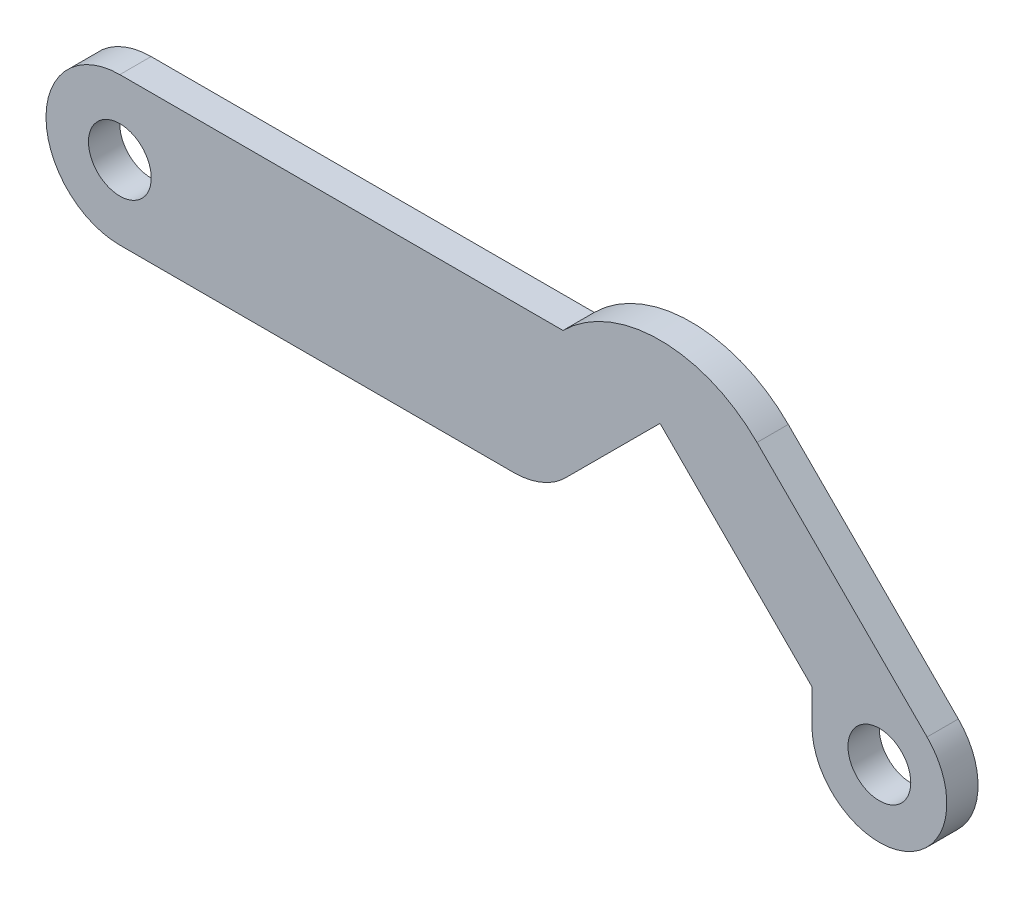
from build123d import *

# Parameters (mm, degrees)
SKETCH1_R            = 3.175
SKETCH1_R_2          = 4.8
BOSS_EXTRUDE1_DEPTH  = 3.175
SKETCH2_W            = 15
SKETCH2_H            = 3.175
CUT_EXTRUDE1_DEPTH   = 46.731068487
CUT_EXTRUDE2_START   = -10
CUT_EXTRUDE2_DEPTH   = 10
SKETCH4_W            = 11.581741037
SKETCH4_H            = 5.573186054
BOSS_EXTRUDE2_DEPTH  = 3.175
SKETCH5_R            = 1.475
CUT_EXTRUDE3_DEPTH   = 16
SKETCH6_W            = 21.273258962
SKETCH6_H            = 7.408259511
BOSS_EXTRUDE4_DEPTH  = 3.175
SKETCH12_R           = 4.8
CUT_EXTRUDE5_DEPTH   = 10
SKETCH15_R           = 4.85
BOSS_EXTRUDE10_DEPTH = 3.175
BOSS_EXTRUDE11_DEPTH = 3.175
BOSS_EXTRUDE12_DEPTH = 3.175
CUT_EXTRUDE6_DEPTH   = 10
CUT_EXTRUDE7_DEPTH   = 10
BOSS_EXTRUDE13_DEPTH = 3.175
BOSS_EXTRUDE14_DEPTH = 3.175
CUT_EXTRUDE8_DEPTH   = 10
SKETCH8_W            = 10
SKETCH8_H            = 3.175
CUT_EXTRUDE4_DEPTH   = 10
BOSS_EXTRUDE15_DEPTH = 3.175
CUT_EXTRUDE10_DEPTH  = 10
CUT_EXTRUDE11_DEPTH  = 10
BOSS_EXTRUDE16_DEPTH = 3.175
CUT_EXTRUDE12_DEPTH  = 3.175
BOSS_EXTRUDE18_DEPTH = 3.175
CUT_EXTRUDE13_DEPTH  = 3.175
BOSS_EXTRUDE19_DEPTH = 3.175
SKETCH32_R           = 6.716159248
SKETCH32_R_2         = 3.1875
BOSS_EXTRUDE20_DEPTH = 3.175
SKETCH33_R           = 7.5
SKETCH33_R_2         = 3.1875
BOSS_EXTRUDE21_DEPTH = 3.175
BOSS_EXTRUDE22_DEPTH = 3.175


with BuildPart() as part:
    # Sketch1 → Boss-Extrude1 (new body)
    with BuildSketch(Plane.XY):
        with BuildLine():
            Line((-37.5, 7.5), (37.5, 7.5))
            ThreePointArc((37.5, 7.5), (45, 0), (37.5, -7.5))
            Line((37.5, -7.5), (-37.5, -7.5))
            ThreePointArc((-37.5, -7.5), (-45, 0), (-37.5, 7.5))
        make_face()
        with Locations((-37.5, 0)):
            Circle(SKETCH1_R, mode=Mode.SUBTRACT)
        with Locations((37.5, 0)):
            Circle(SKETCH1_R_2, mode=Mode.SUBTRACT)
    extrude(amount=BOSS_EXTRUDE1_DEPTH)

    # Sketch2 → Cut-Extrude1 (cut, through all)
    with BuildSketch(Plane.XY.offset(3.175)):
        with Locations((-17.5, 0.21703664)):
            Rectangle(SKETCH2_W, SKETCH2_H)
        with Locations((17.5, 0.853492694)):
            Rectangle(SKETCH2_W, SKETCH2_H)
    extrude(amount=-CUT_EXTRUDE1_DEPTH, mode=Mode.SUBTRACT)

    # Sketch3 → Cut-Extrude2 (cut)
    with BuildSketch(Plane.XY.offset(3.175).offset(CUT_EXTRUDE2_START)):
        with BuildLine():
            Line((-56.505330914, 0), (-45, 0))
            ThreePointArc((-45, 0), (-42.803300859, 5.303300859), (-37.5, 7.5))
            Line((-37.5, 7.5), (-20.71, 7.5))
            Line((-20.71, 7.5), (-20.71, 17.128469338))
            Line((-20.71, 17.128469338), (-56.505330914, 17.128469338))
            Line((-56.505330914, 17.128469338), (-56.505330914, 0))
        make_face()
        with BuildLine():
            ThreePointArc((-37.5, -7.5), (-42.803300859, -5.303300859), (-45, 0))
            Line((-45, 0), (-56.505330914, 0))
            Line((-56.505330914, 0), (-56.505330914, -10.2398458))
            Line((-56.505330914, -10.2398458), (-20.71, -10.2398458))
            Line((-20.71, -10.2398458), (-20.71, -7.5))
            Line((-20.71, -7.5), (-37.5, -7.5))
        make_face()
        with BuildLine():
            ThreePointArc((-40.675, 0), (-37.5, 3.175), (-34.325, 0))
            Line((-34.325, 0), (-25, 0))
            Line((-25, 0), (-25, 1.80453664))
            Line((-25, 1.80453664), (-20.71, 1.80453664))
            Line((-20.71, 1.80453664), (-20.71, 7.5))
            Line((-20.71, 7.5), (-37.5, 7.5))
            ThreePointArc((-37.5, 7.5), (-42.803300859, 5.303300859), (-45, 0))
            Line((-45, 0), (-40.675, 0))
        make_face()
        with BuildLine():
            Line((-25, 0), (-34.325, 0))
            ThreePointArc((-34.325, 0), (-37.5, -3.175), (-40.675, 0))
            Line((-40.675, 0), (-45, 0))
            ThreePointArc((-45, 0), (-42.803300859, -5.303300859), (-37.5, -7.5))
            Line((-37.5, -7.5), (-20.71, -7.5))
            Line((-20.71, -7.5), (-20.71, -1.37046336))
            Line((-20.71, -1.37046336), (-25, -1.37046336))
            Line((-25, -1.37046336), (-25, 0))
        make_face()
    extrude(amount=CUT_EXTRUDE2_DEPTH, mode=Mode.SUBTRACT)

    # Sketch4 → Boss-Extrude2 (add)
    with BuildSketch(Plane.XY.offset(3.175)):
        with Locations((-14.919129482, -0.129821549)):
            Rectangle(SKETCH4_W, SKETCH4_H)
    extrude(amount=-BOSS_EXTRUDE2_DEPTH)

    # Sketch5 → Cut-Extrude3 (cut)
    with BuildSketch(Plane.XY.offset(3.175)):
        with Locations((-13.5, 0)):
            Circle(SKETCH5_R)
        with Locations((2.5, 0)):
            Circle(SKETCH5_R)
    extrude(amount=-CUT_EXTRUDE3_DEPTH, mode=Mode.SUBTRACT)

    # Sketch6 → Boss-Extrude4 (add)
    with BuildSketch(Plane.XY.offset(3.175)):
        with Locations((18.907585517, 0.667769414)):
            Rectangle(SKETCH6_W, SKETCH6_H)
    extrude(amount=-BOSS_EXTRUDE4_DEPTH)

    # Sketch12 → Cut-Extrude5 (cut)
    # profile 1 of 2: a face of its own
    with BuildSketch(Plane(origin=(0, 0, 0), x_dir=(-1, 0, 0), z_dir=(0, 0, -1))):
        with BuildLine():
            Line((-2.5, 7.5), (-37.5, 7.5))
            ThreePointArc((-37.5, 7.5), (-32.196699141, 5.303300859), (-30, 0))
            ThreePointArc((-30, 0), (-32.196699141, -5.303300859), (-37.5, -7.5))
            Line((-37.5, -7.5), (-2.5, -7.5))
            ThreePointArc((-2.5, -7.5), (-10, 0), (-2.5, 7.5))
        make_face()
    # profile 2 of 2: a face of its own
    with BuildSketch(Plane(origin=(0, 0, 0), x_dir=(-1, 0, 0), z_dir=(0, 0, -1))):
        with BuildLine():
            ThreePointArc((-30, 0), (-32.196699141, 5.303300859), (-37.5, 7.5))
            ThreePointArc((-37.5, 7.5), (-45, 0), (-37.5, -7.5))
            ThreePointArc((-37.5, -7.5), (-32.196699141, -5.303300859), (-30, 0))
        make_face()
        with Locations((-37.5, 0)):
            Circle(SKETCH12_R, mode=Mode.SUBTRACT)
    extrude(amount=-CUT_EXTRUDE5_DEPTH, mode=Mode.SUBTRACT)

    # Sketch15 → Boss-Extrude10 (add)
    with BuildSketch(Plane(origin=(0, 0, 0), x_dir=(-1, 0, 0), z_dir=(0, 0, -1))):
        with BuildLine():
            ThreePointArc((-46.001929081, -17.143138466), (-35.871769222, -20.337345998), (-34.79216247, -9.770532392))
            Line((-34.79216247, -9.770532392), (-34.739826286, -9.718196208))
            ThreePointArc((-34.739826286, -9.718196208), (-27.229011247, 7.510815039), (-10, 0))
            ThreePointArc((-10, 0), (-7.803300859, 5.303300859), (-2.5, 7.5))
            ThreePointArc((-2.5, 7.5), (-36.707777113, 17.168137065), (-46.001929081, -17.143138466))
        make_face()
        with Locations((-39.635843921, -14.614213843)):
            Circle(SKETCH15_R, mode=Mode.SUBTRACT)
    extrude(amount=-BOSS_EXTRUDE10_DEPTH)

    # Sketch16 → Boss-Extrude11 (add)
    with BuildSketch(Plane(origin=(0, 0, 0), x_dir=(-1, 0, 0), z_dir=(0, 0, -1))):
        with BuildLine():
            Line((-21.509690563, 8.403088845), (-7.803300859, -5.303300859))
            ThreePointArc((-7.803300859, -5.303300859), (-9.429096494, -2.870125743), (-10, 0))
            ThreePointArc((-10, 0), (-14.533325981, 5.874656467), (-21.509690563, 8.403088845))
        make_face()
    extrude(amount=-BOSS_EXTRUDE11_DEPTH)

    # Sketch17 → Boss-Extrude12 (add)
    with BuildSketch(Plane(origin=(0, 0, 0), x_dir=(-1, 0, 0), z_dir=(0, 0, -1))):
        with BuildLine():
            Line((-20.755882022, 9.519320843), (-23.45404322, 8.658356332))
            ThreePointArc((-23.45404322, 8.658356332), (-23.129421083, 8.546024811), (-22.808422976, 8.423721426))
            ThreePointArc((-22.808422976, 8.423721426), (-22.158804554, 8.429280981), (-21.509690563, 8.403088845))
            Line((-21.509690563, 8.403088845), (-19.064115898, 5.95751418))
            Line((-19.064115898, 5.95751418), (-20.755882022, 9.519320843))
        make_face()
        with BuildLine():
            ThreePointArc((-21.509690563, 8.403088845), (-22.158804554, 8.429280981), (-22.808422976, 8.423721426))
            ThreePointArc((-22.808422976, 8.423721426), (-20.81070119, 7.38126118), (-19.064115898, 5.95751418))
            Line((-19.064115898, 5.95751418), (-21.509690563, 8.403088845))
        make_face()
        with BuildLine():
            ThreePointArc((-23.45404322, 8.658356332), (-36.40040662, 3.921172604), (-34.79216247, -9.770532392))
            Line((-34.79216247, -9.770532392), (-34.739826286, -9.718196208))
            ThreePointArc((-34.739826286, -9.718196208), (-33.473796187, 2.443597762), (-22.808422976, 8.423721426))
            ThreePointArc((-22.808422976, 8.423721426), (-23.129421083, 8.546024811), (-23.45404322, 8.658356332))
        make_face()
        with BuildLine():
            ThreePointArc((-22.808422976, 8.423721426), (-33.473796187, 2.443597762), (-34.739826286, -9.718196208))
            Line((-34.739826286, -9.718196208), (-32.925869648, -7.90423957))
            Line((-32.925869648, -7.90423957), (-19.064115898, 5.95751418))
            ThreePointArc((-19.064115898, 5.95751418), (-20.81070119, 7.38126118), (-22.808422976, 8.423721426))
        make_face()
    extrude(amount=-BOSS_EXTRUDE12_DEPTH)

    # Sketch18 → Cut-Extrude6 (cut)
    with BuildSketch(Plane(origin=(0, 0, 0), x_dir=(-1, 0, 0), z_dir=(0, 0, -1))):
        Polygon((-49.385473713, -4.584123483), (-24.385473713, 20.415876517), (-30.56765092, 24.378047278), (-55.403941692, 2.136458495), align=None)
    extrude(amount=-CUT_EXTRUDE6_DEPTH, mode=Mode.SUBTRACT)

    # Sketch19 → Cut-Extrude7 (cut)
    with BuildSketch(Plane(origin=(0, 0, 0), x_dir=(-1, 0, 0), z_dir=(0, 0, -1))):
        with BuildLine():
            ThreePointArc((-46.001929081, -17.143138466), (-46.344312222, -13.228951032), (-44.479525373, -9.770532392))
            Line((-44.479525373, -9.770532392), (-15.809929944, 18.899063036))
            ThreePointArc((-15.809929944, 18.899063036), (-20.031146151, 20.033752776), (-24.385473713, 20.415876517))
            Line((-24.385473713, 20.415876517), (-49.385473713, -4.584123483))
            ThreePointArc((-49.385473713, -4.584123483), (-48.524771385, -11.08753089), (-46.001929081, -17.143138466))
        make_face()
    extrude(amount=-CUT_EXTRUDE7_DEPTH, mode=Mode.SUBTRACT)

    # Sketch20 → Boss-Extrude13 (add)
    with BuildSketch(Plane(origin=(0, 0, 0), x_dir=(-1, 0, 0), z_dir=(0, 0, -1))):
        with BuildLine():
            Line((-32.785843921, -14.614213843), (-32.785843921, -7.764213843))
            ThreePointArc((-32.785843921, -7.764213843), (-34.411726772, -8.208442505), (-35.585840533, -9.417694765))
            Line((-35.585840533, -9.417694765), (-32.785843921, -14.614213843))
        make_face()
        Polygon((-46.485843921, -14.614213843), (-46.485843921, -7.764213843), (-15.809929944, 18.899063036), align=None)
    extrude(amount=-BOSS_EXTRUDE13_DEPTH)

    # Sketch21 → Boss-Extrude14 (add)
    with BuildSketch(Plane(origin=(0, 0, 0), x_dir=(-1, 0, 0), z_dir=(0, 0, -1))):
        with BuildLine():
            Line((-15.809929944, 18.899063036), (-3.494683458, 5.188322232))
            Line((-3.494683458, 5.188322232), (20.71, 7.5))
            ThreePointArc((20.71, 7.5), (3.510589711, 16.597300494), (-15.809929944, 18.899063036))
        make_face()
    extrude(amount=-BOSS_EXTRUDE14_DEPTH)

    # Sketch22 → Cut-Extrude8 (cut)
    with BuildSketch(Plane(origin=(0, 0, 0), x_dir=(-1, 0, 0), z_dir=(0, 0, -1))):
        with BuildLine():
            ThreePointArc((-7.803300859, -5.303300859), (-9.665367717, 2.215289028), (-3.884823194, 7.371042309))
            Line((-3.884823194, 7.371042309), (-19.064115898, 5.95751418))
            Line((-19.064115898, 5.95751418), (-7.803300859, -5.303300859))
        make_face()
    extrude(amount=-CUT_EXTRUDE8_DEPTH, mode=Mode.SUBTRACT)

    # Sketch8 → Cut-Extrude4 (cut)
    with BuildSketch(Plane.XY.offset(3.175)):
        with Locations((19, 0)):
            Rectangle(SKETCH8_W, SKETCH8_H)
    extrude(amount=-CUT_EXTRUDE4_DEPTH, mode=Mode.SUBTRACT)

    # Sketch24 → Boss-Extrude15 (add)
    with BuildSketch(Plane(origin=(0, 0, 0), x_dir=(-1, 0, 0), z_dir=(0, 0, -1))):
        Polygon((-32.785843921, -7.764213843), (-19.064115898, 5.95751418), (-25.92497991, 1.835763138), align=None)
    extrude(amount=-BOSS_EXTRUDE15_DEPTH)

    # Sketch25 → Cut-Extrude10 (cut)
    with BuildSketch(Plane(origin=(0, 0, 0), x_dir=(-1, 0, 0), z_dir=(0, 0, -1))):
        with BuildLine():
            ThreePointArc((-46.485843921, -14.614213843), (-45.964418719, -11.992832332), (-44.479525373, -9.770532392))
            Line((-44.479525373, -9.770532392), (-15.809929944, 18.899063036))
            Line((-15.809929944, 18.899063036), (-46.485843921, -7.764213843))
            Line((-46.485843921, -7.764213843), (-46.485843921, -14.614213843))
        make_face()
    extrude(amount=-CUT_EXTRUDE10_DEPTH, mode=Mode.SUBTRACT)

    # Sketch26 → Cut-Extrude11 (cut)
    with BuildSketch(Plane(origin=(0, 0, 0), x_dir=(-1, 0, 0), z_dir=(0, 0, -1))):
        with BuildLine():
            Line((-15.809929944, 18.899063036), (-23.907797349, 10.801195631))
            ThreePointArc((-23.907797349, 10.801195631), (-1.26089762, 15.105031891), (20.545662044, 7.629804166))
            ThreePointArc((20.545662044, 7.629804166), (3.410605692, 16.628400783), (-15.809929944, 18.899063036))
        make_face()
        with BuildLine():
            Line((-24.462923893, 21.153371093), (-23.907797349, 10.801195631))
            Line((-23.907797349, 10.801195631), (-15.809929944, 18.899063036))
            ThreePointArc((-15.809929944, 18.899063036), (3.410605692, 16.628400783), (20.545662044, 7.629804166))
            Line((20.545662044, 7.629804166), (12.510465987, 32.510755223))
            Line((12.510465987, 32.510755223), (-24.462923893, 21.153371093))
        make_face()
    extrude(amount=-CUT_EXTRUDE11_DEPTH, mode=Mode.SUBTRACT)

    # Sketch27 → Boss-Extrude16 (add)
    with BuildSketch(Plane(origin=(0, 0, 0), x_dir=(-1, 0, 0), z_dir=(0, 0, -1))):
        with BuildLine():
            ThreePointArc((-8.038695105, -5.056961196), (-9.359104011, -3.033593935), (-9.967690986, -0.69540732))
            ThreePointArc((-9.967690986, -0.69540732), (-8.488209602, 4.515677775), (-3.884823194, 7.371042309))
            Line((-3.884823194, 7.371042309), (-19.064115898, 5.95751418))
            Line((-19.064115898, 5.95751418), (-8.038695105, -5.056961196))
        make_face()
    extrude(amount=-BOSS_EXTRUDE16_DEPTH)

    # Sketch28 → Cut-Extrude12 (cut)
    with BuildSketch(Plane(origin=(0, 0, 0), x_dir=(-1, 0, 0), z_dir=(0, 0, -1))):
        Polygon((20.71, 7.5), (-23.907797349, 10.801195631), (-10.730396659, 19.898602306), (15.158212603, 17.043524683), align=None)
    extrude(amount=-CUT_EXTRUDE12_DEPTH, mode=Mode.SUBTRACT)

    # Sketch29 → Boss-Extrude18 (add)
    with BuildSketch(Plane(origin=(0, 0, 0), x_dir=(-1, 0, 0), z_dir=(0, 0, -1))):
        Polygon((-19.064115898, 5.95751418), (-32.785843921, -7.764213843), (-32.785843921, -11.189213843), (-17.358434587, 4.253526174), align=None)
    extrude(amount=-BOSS_EXTRUDE18_DEPTH)

    # Sketch30 → Cut-Extrude13 (cut)
    with BuildSketch(Plane(origin=(0, 0, 0), x_dir=(-1, 0, 0), z_dir=(0, 0, -1))):
        Polygon((20.71, 7.5), (-29.726171722, 7.5), (-24.020649075, 17.421001934), align=None)
    extrude(amount=-CUT_EXTRUDE13_DEPTH, mode=Mode.SUBTRACT)

    # Sketch31 → Boss-Extrude19 (add)
    with BuildSketch(Plane(origin=(0, 0, 0), x_dir=(-1, 0, 0), z_dir=(0, 0, -1))):
        with BuildLine():
            Line((-27.20899298, 7.5), (-7.507876194, 7.5))
            ThreePointArc((-7.507876194, 7.5), (-17.358434587, 11.580234883), (-27.20899298, 7.5))
        make_face()
    extrude(amount=-BOSS_EXTRUDE19_DEPTH)

    # Sketch32 → Boss-Extrude20 (add)
    with BuildSketch(Plane(origin=(0, 0, 0), x_dir=(-1, 0, 0), z_dir=(0, 0, -1))):
        with Locations((-39.635843921, -14.614213843)):
            Circle(SKETCH32_R)
        with Locations((-39.635843921, -14.614213843)):
            Circle(SKETCH32_R_2, mode=Mode.SUBTRACT)
    extrude(amount=-BOSS_EXTRUDE20_DEPTH)

    # Sketch33 → Boss-Extrude21 (add)
    # profile 1 of 2: a face of its own
    with BuildSketch(Plane(origin=(0, 0, 0), x_dir=(-1, 0, 0), z_dir=(0, 0, -1))):
        with Locations((37.5, 0)):
            Circle(SKETCH33_R)
        with Locations((37.5, 0)):
            Circle(SKETCH33_R_2, mode=Mode.SUBTRACT)
    # profile 2 of 2: a face of its own
    with BuildSketch(Plane(origin=(0, 0, 0), x_dir=(-1, 0, 0), z_dir=(0, 0, -1))):
        with BuildLine():
            ThreePointArc((37.5, -7.5), (30, 0), (37.5, 7.5))
            Line((37.5, 7.5), (20.71, 7.5))
            Line((20.71, 7.5), (20.71, -7.5))
            Line((20.71, -7.5), (37.5, -7.5))
        make_face()
    extrude(amount=-BOSS_EXTRUDE21_DEPTH)

    # Sketch34 → Boss-Extrude22 (add)
    with BuildSketch(Plane(origin=(0, 0, 0), x_dir=(-1, 0, 0), z_dir=(0, 0, -1))):
        Polygon((-7.65894818, 0.566705822), (2.634672239, -5.625550211), (22.417723982, -2.529422194), (20.165994516, 3.944300022), (-4.120516161, 3.944300022), align=None)
    extrude(amount=-BOSS_EXTRUDE22_DEPTH)


solid = part.part
